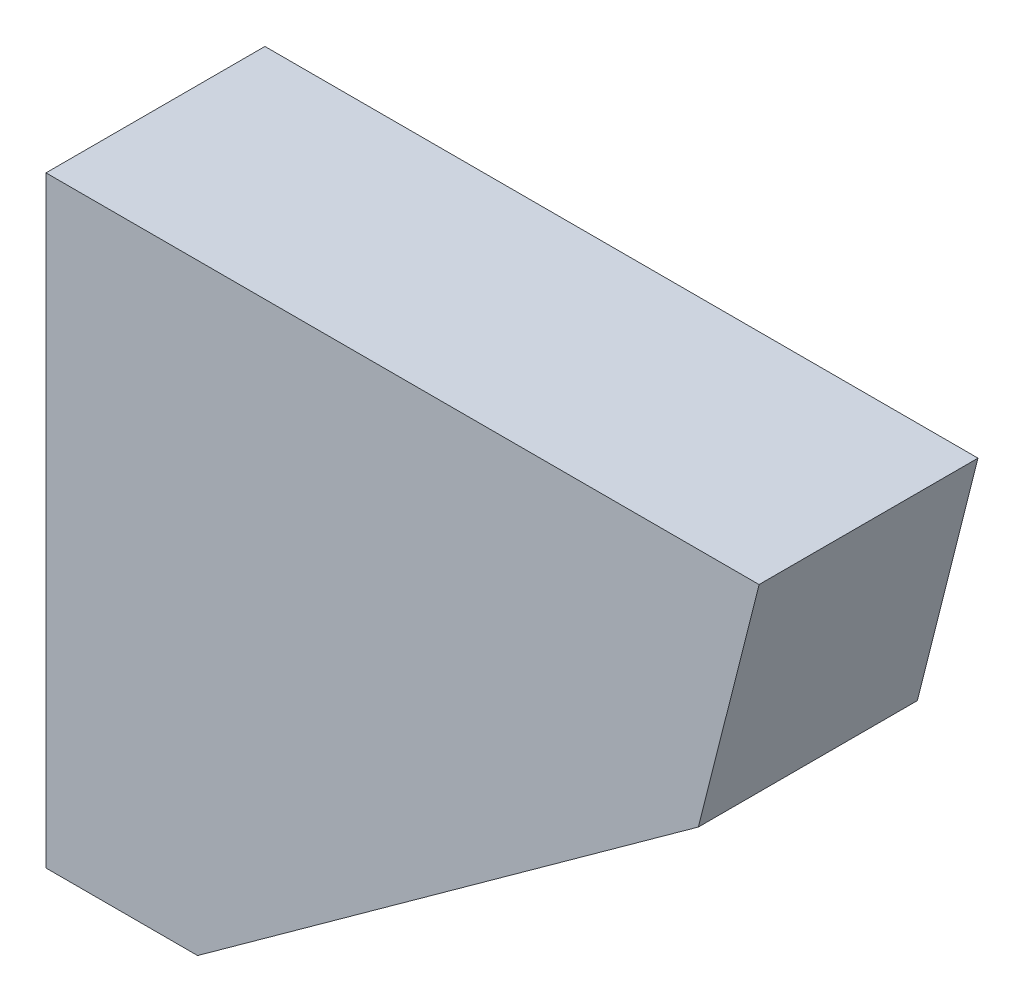
from build123d import *

# Parameters (mm, degrees)
EXTRUDE_1_DEPTH = 8
CHAMFER_1_SIZE  = 4
CHAMFER_1_SIZE2 = 6.831877942
CHAMFER_2_SIZE  = 15
CHAMFER_2_SIZE2 = 9.944050138


with BuildPart() as part:
    # Эскиз1 → Вытянуть1 (new body)
    with BuildSketch(Plane.XY):
        Polygon((0, 0), (0, -26), (36, 0), align=None)
    extrude(amount=EXTRUDE_1_DEPTH)

    # Фаска1
    chamfer_1_edges = [part.edges().sort_by_distance(p)[0] for p in [
        (0, -26, 4),
    ]]
    chamfer_1_side = [part.faces().sort_by_distance(p)[0] for p in [
        (0, -13, 4),
    ]]
    chamfer(chamfer_1_edges, length=CHAMFER_1_SIZE, length2=CHAMFER_1_SIZE2, reference=chamfer_1_side[0])

    # Фаска2
    chamfer_2_edges = [part.edges().sort_by_distance(p)[0] for p in [
        (36, 0, 4),
    ]]
    chamfer_2_side = [part.faces().sort_by_distance(p)[0] for p in [
        (20.769230769, -11, 4),
    ]]
    chamfer(chamfer_2_edges, length=CHAMFER_2_SIZE, length2=CHAMFER_2_SIZE2, reference=chamfer_2_side[0])


solid = part.part
